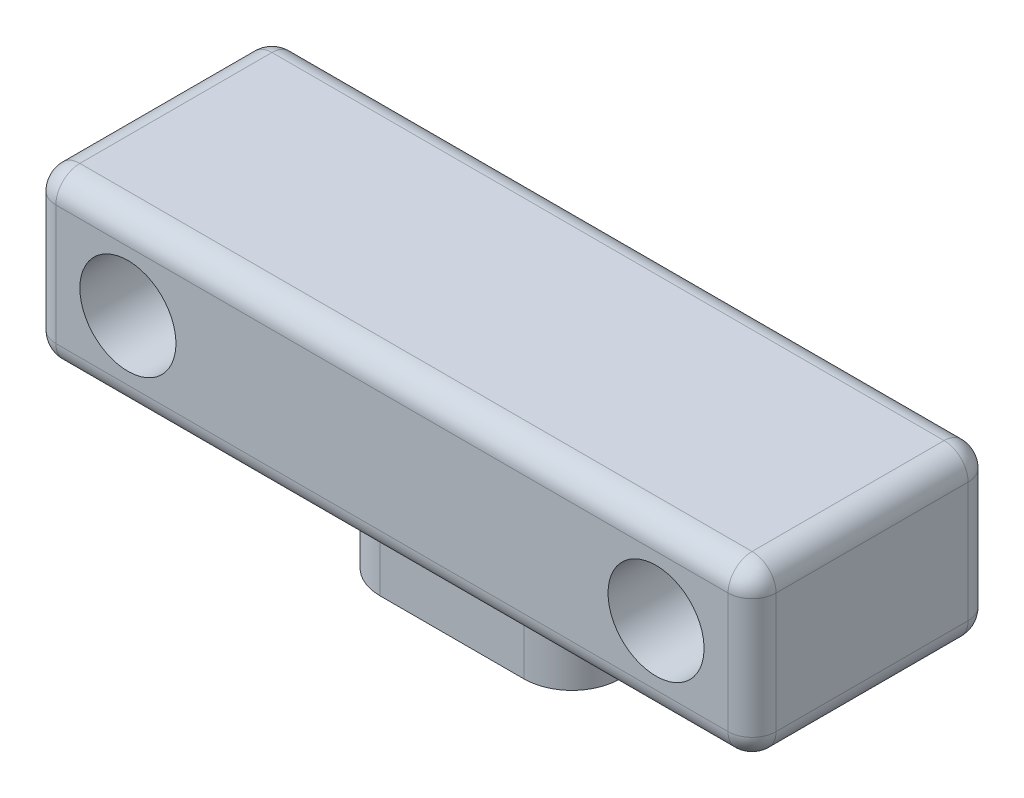
from build123d import *

# Parameters (mm, degrees)
BOSS_EXTRUDE1_DEPTH      = 1.85
BOSS_EXTRUDE1_DEPTH_BACK = 2
SKETCH1_R                = 2
SKETCH3_W                = 30
SKETCH3_H                = 10
BOSS_EXTRUDE3_DEPTH      = 7
SKETCH7_W                = 10
SKETCH7_H                = 5
BOSS_EXTRUDE7_DEPTH      = 2
FILLET2_R                = 2
SKETCH9_R                = 2
CUT_EXTRUDE3_DEPTH       = 10
FILLET3_R                = 1


with BuildPart() as part:
    # Sketch1 → Boss-Extrude1 (new, two sides: drawn at the far end of the back side and taken through both)
    with BuildSketch(Plane(origin=(0, 0, 0), x_dir=(1, 0, 0), z_dir=(0, 1, 0)).offset(-BOSS_EXTRUDE1_DEPTH_BACK)):
        with Locations(Location((0, 0, 0), (0, 0, 270))):
            Circle(SKETCH1_R)
    extrude(amount=BOSS_EXTRUDE1_DEPTH + BOSS_EXTRUDE1_DEPTH_BACK)

    # Sketch3 → Boss-Extrude3 (add)
    with BuildSketch(Plane(origin=(0, 1.85, 0), x_dir=(1, 0, 0), z_dir=(0, 1, 0))):
        Rectangle(SKETCH3_W, SKETCH3_H)
    extrude(amount=BOSS_EXTRUDE3_DEPTH)

    # Sketch7 → Boss-Extrude7 (add)
    with BuildSketch(Plane.XZ.offset(2)):
        Rectangle(SKETCH7_W, SKETCH7_H)
    extrude(amount=-BOSS_EXTRUDE7_DEPTH)

    # Fillet2
    fillet2_edges = [part.edges().sort_by_distance(p)[0] for p in [
        (5, -1, 2.5),
        (5, -1, -2.5),
        (-5, -1, -2.5),
        (-5, -1, 2.5),
    ]]
    fillet(fillet2_edges, radius=FILLET2_R)

    # Sketch9 → Cut-Extrude3 (cut)
    with BuildSketch(Plane(origin=(0, 0, -5), x_dir=(-1, 0, 0), z_dir=(0, 0, -1))):
        with Locations((-11, 5.35)):
            Circle(SKETCH9_R)
        with Locations((11, 5.35)):
            Circle(SKETCH9_R)
    extrude(amount=-CUT_EXTRUDE3_DEPTH, mode=Mode.SUBTRACT)

    # Fillet3
    fillet3_edges = [part.edges().sort_by_distance(p)[0] for p in [
        (-15, 5.35, 5),
        (15, 8.85, 0),
        (0, 8.85, -5),
        (-15, 8.85, 0),
        (0, 8.85, 5),
        (15, 1.85, 0),
        (15, 5.35, 5),
        (0, 1.85, -5),
        (15, 5.35, -5),
        (-15, 1.85, 0),
        (-15, 5.35, -5),
        (0, 1.85, 5),
    ]]
    fillet(fillet3_edges, radius=FILLET3_R)


solid = part.part
